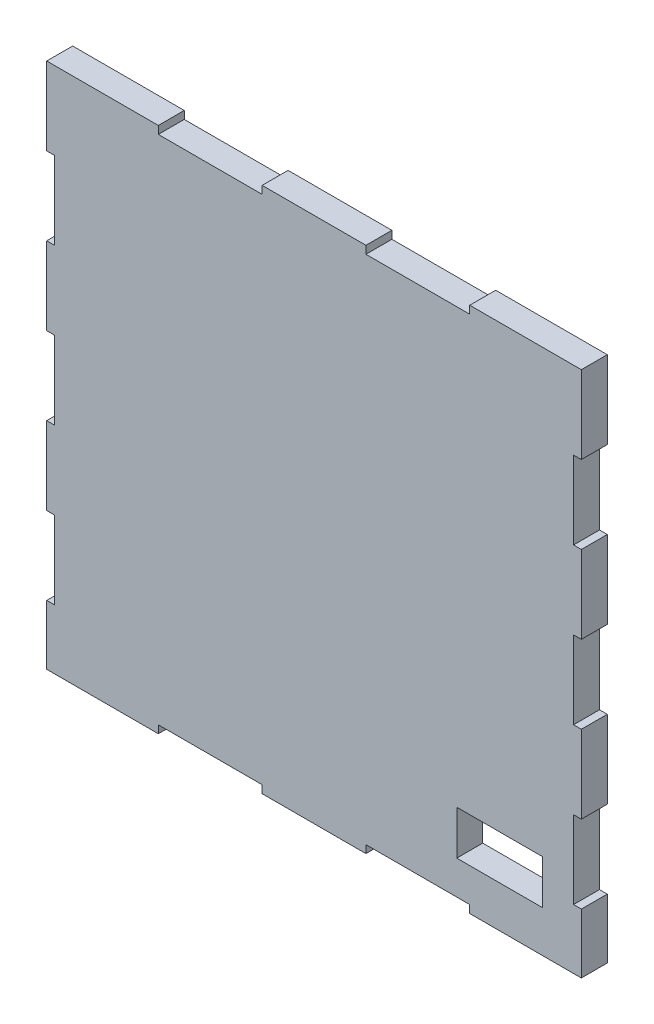
from build123d import *

# Parameters (mm, degrees)
SKETCH1_W           = 40
SKETCH1_H           = 3
SKETCH1_W_2         = 43
BOSS_EXTRUDE1_DEPTH = 10


with BuildPart() as part:
    # Sketch1 → Boss-Extrude1 (new body)
    with BuildSketch(Plane.XY):
        with Locations((0, 100)):
            Rectangle(SKETCH1_W, SKETCH1_H)
        with Locations((-81.5, 100)):
            Rectangle(SKETCH1_W_2, SKETCH1_H)
        with Locations((81.5, 100)):
            Rectangle(SKETCH1_W_2, SKETCH1_H)
        with Locations((81.5, -100)):
            Rectangle(SKETCH1_W_2, SKETCH1_H)
        with Locations((0, -100)):
            Rectangle(SKETCH1_W, SKETCH1_H)
        with Locations((-81.5, -100)):
            Rectangle(SKETCH1_W_2, SKETCH1_H)
        Polygon((88, -84.155339806), (103, -98.5), (103, -78.5), (100, -78.5), (100, -48.5), (103, -48.5), (103, -18.5), (100, -18.5), (100, 11.5), (103, 11.5), (103, 41.5), (100, 41.5), (100, 71.5), (103, 71.5), (103, 98.5), (60, 98.5), (20, 98.5), (-20, 98.5), (-60, 98.5), (-103, 98.5), (71.629441624, -68.5), (88, -68.5), align=None)
        Polygon((-103, -78.5), (-103, -98.5), (-60, -98.5), (-20, -98.5), (20, -98.5), (60, -98.5), (103, -98.5), (88, -84.155339806), (88, -85.5), (55, -85.5), (55, -68.5), (71.629441624, -68.5), (-103, 98.5), (-103, 71.5), (-100, 71.5), (-100, 41.5), (-103, 41.5), (-103, 11.5), (-100, 11.5), (-100, -18.5), (-103, -18.5), (-103, -48.5), (-100, -48.5), (-100, -78.5), align=None)
    extrude(amount=BOSS_EXTRUDE1_DEPTH)


solid = part.part
